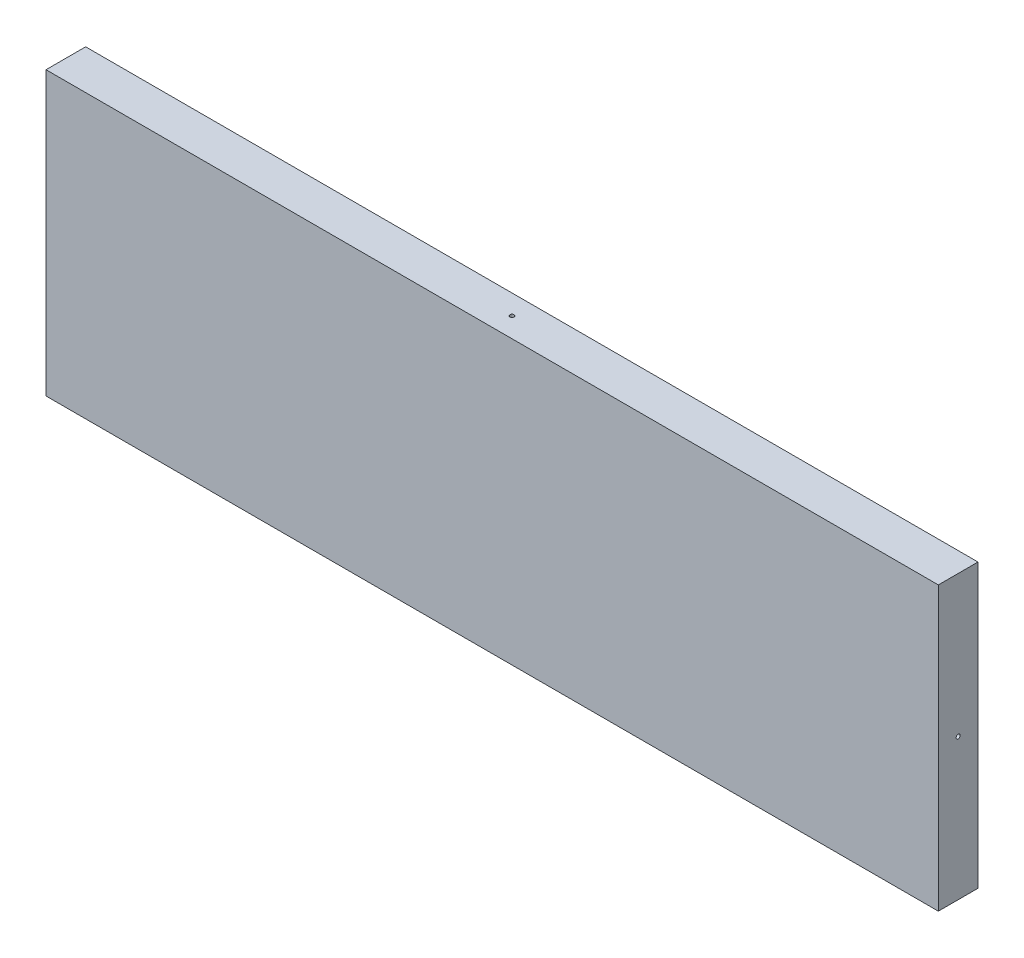
from build123d import *

# Parameters (mm, degrees)
SKETCH_1_W         = 900
SKETCH_1_H         = 285
EXTRUDE_1_DEPTH    = 40
HOLE_WIZARD_M5_1_D = 4.2
HOLE_WIZARD_M5_2_D = 4.2


with BuildPart() as part:
    # 草图1 → 凸台-拉伸1 (new body)
    with BuildSketch(Plane.XY):
        Rectangle(SKETCH_1_W, SKETCH_1_H)
    extrude(amount=EXTRUDE_1_DEPTH)

    # M5 螺纹孔1 (through all)
    with Locations(Plane(origin=(0, 142.5, 0), x_dir=(1, 0, 0), z_dir=(0, 1, 0))):
        with Locations((0, -20)):
            Hole(HOLE_WIZARD_M5_1_D / 2)

    # M5 螺纹孔2 (through all)
    with Locations(Plane.ZY.offset(450)):
        with Locations((20, 0)):
            Hole(HOLE_WIZARD_M5_2_D / 2)


solid = part.part
